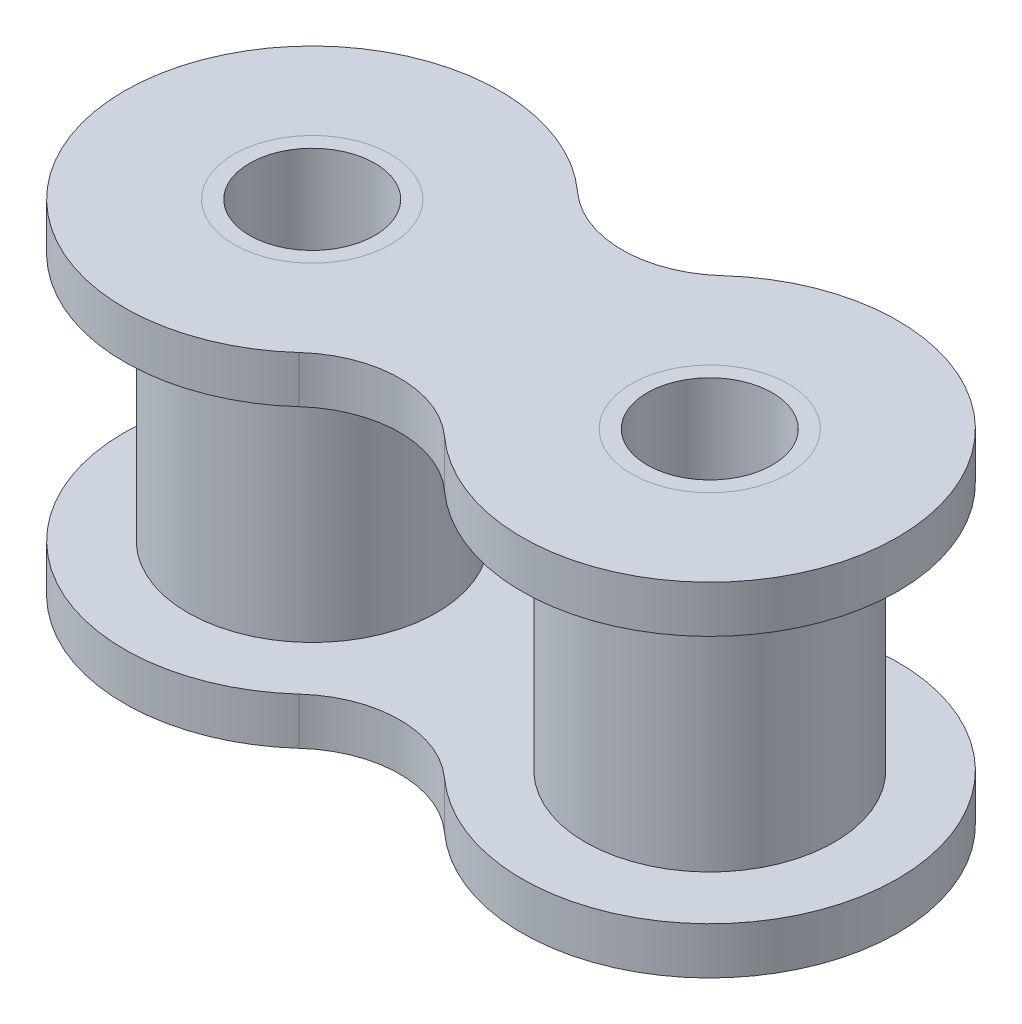
from build123d import *

# Parameters (mm, degrees)
ESBO_O85_R                = 2.5
RESSALTO_EXTRUS_O9_DEPTH  = 1.5
ESBO_O90_R                = 2.5
RESSALTO_EXTRUS_O10_DEPTH = 1.5
ESBO_O96_W                = 1.475
ESBO_O96_H                = 7.95
ESBO_O103_W               = 1.475
ESBO_O103_H               = 7.95
ESBO_O110_W               = 0.5
ESBO_O110_H               = 10.95
ESBO_O117_W               = 0.5
ESBO_O117_H               = 10.95


with BuildPart() as part:
    # Esboço85 → Ressalto-extrusão9 (new body)
    with BuildSketch(Plane(origin=(0, 5.475, 0), x_dir=(1, 0, 0), z_dir=(0, 1, 0))):
        with BuildLine():
            ThreePointArc((2.319994603, 4.445116028), (0, 3.55), (-2.319994603, 4.445116028))
            ThreePointArc((-2.319994603, 4.445116028), (-12.35, 0), (-2.319994603, -4.445116028))
            ThreePointArc((-2.319994603, -4.445116028), (0, -3.55), (2.319994603, -4.445116028))
            ThreePointArc((2.319994603, -4.445116028), (12.35, 0), (2.319994603, 4.445116028))
        make_face()
        with Locations(Location((6.35, 0, 0), (0, 0, 270))):
            Circle(ESBO_O85_R, mode=Mode.SUBTRACT)
        with Locations(Location((-6.35, 0, 0), (0, 0, 270))):
            Circle(ESBO_O85_R, mode=Mode.SUBTRACT)
    extrude(amount=-RESSALTO_EXTRUS_O9_DEPTH)


with BuildPart() as body_2:
    # Esboço90 → Ressalto-extrusão10 (new body)
    with BuildSketch(Plane(origin=(0, -5.475, 0), x_dir=(-1, 0, 0), z_dir=(0, -1, 0))):
        with BuildLine():
            ThreePointArc((2.319994603, 4.445116028), (0, 3.55), (-2.319994603, 4.445116028))
            ThreePointArc((-2.319994603, 4.445116028), (-12.35, 0), (-2.319994603, -4.445116028))
            ThreePointArc((-2.319994603, -4.445116028), (0, -3.55), (2.319994603, -4.445116028))
            ThreePointArc((2.319994603, -4.445116028), (12.35, 0), (2.319994603, 4.445116028))
        make_face()
        with Locations(Location((-6.35, 0, 0), (0, 0, 90))):
            Circle(ESBO_O90_R, mode=Mode.SUBTRACT)
        with Locations(Location((6.35, 0, 0), (0, 0, 90))):
            Circle(ESBO_O90_R, mode=Mode.SUBTRACT)
    extrude(amount=-RESSALTO_EXTRUS_O10_DEPTH)


with BuildPart() as body_3:
    # Esboço96 → Revolução13 (revolve)
    with BuildSketch(Plane(origin=(0, 0, 0), x_dir=(-1, 0, 0), z_dir=(0, 0, -1)), mode=Mode.PRIVATE) as revolu_o13_sk:
        with Locations((3.1125, 0)):
            Rectangle(ESBO_O96_W, ESBO_O96_H)
    revolve(revolu_o13_sk.sketch.rotate(Axis((-6.35, -3.975, 0), (0, 1, 0)), 270), axis=Axis((-6.35, -3.975, 0), (0, 1, 0)))


with BuildPart() as body_4:
    # Esboço103 → Revolução14 (revolve)
    with BuildSketch(Plane(origin=(0, 0, 0), x_dir=(-1, 0, 0), z_dir=(0, 0, -1)), mode=Mode.PRIVATE) as revolu_o14_sk:
        with Locations((-9.5875, 0)):
            Rectangle(ESBO_O103_W, ESBO_O103_H)
    revolve(revolu_o14_sk.sketch.rotate(Axis((6.35, -3.975, 0), (0, 1, 0)), 270), axis=Axis((6.35, -3.975, 0), (0, 1, 0)))


with BuildPart() as body_5:
    # Esboço110 → Revolução15 (revolve)
    with BuildSketch(Plane(origin=(0, 0, 0), x_dir=(-1, 0, 0), z_dir=(0, 0, -1)), mode=Mode.PRIVATE) as revolu_o15_sk:
        with Locations((4.1, 0)):
            Rectangle(ESBO_O110_W, ESBO_O110_H)
    revolve(revolu_o15_sk.sketch.rotate(Axis((-6.35, -5.475, 0), (0, 1, 0)), 270), axis=Axis((-6.35, -5.475, 0), (0, 1, 0)))


with BuildPart() as body_6:
    # Esboço117 → Revolução16 (revolve)
    with BuildSketch(Plane(origin=(0, 0, 0), x_dir=(-1, 0, 0), z_dir=(0, 0, -1)), mode=Mode.PRIVATE) as revolu_o16_sk:
        with Locations((-8.6, 0)):
            Rectangle(ESBO_O117_W, ESBO_O117_H)
    revolve(revolu_o16_sk.sketch.rotate(Axis((6.35, -5.475, 0), (0, 1, 0)), 270), axis=Axis((6.35, -5.475, 0), (0, 1, 0)))


solid = Compound([part.part, body_2.part, body_3.part, body_4.part, body_5.part, body_6.part])
